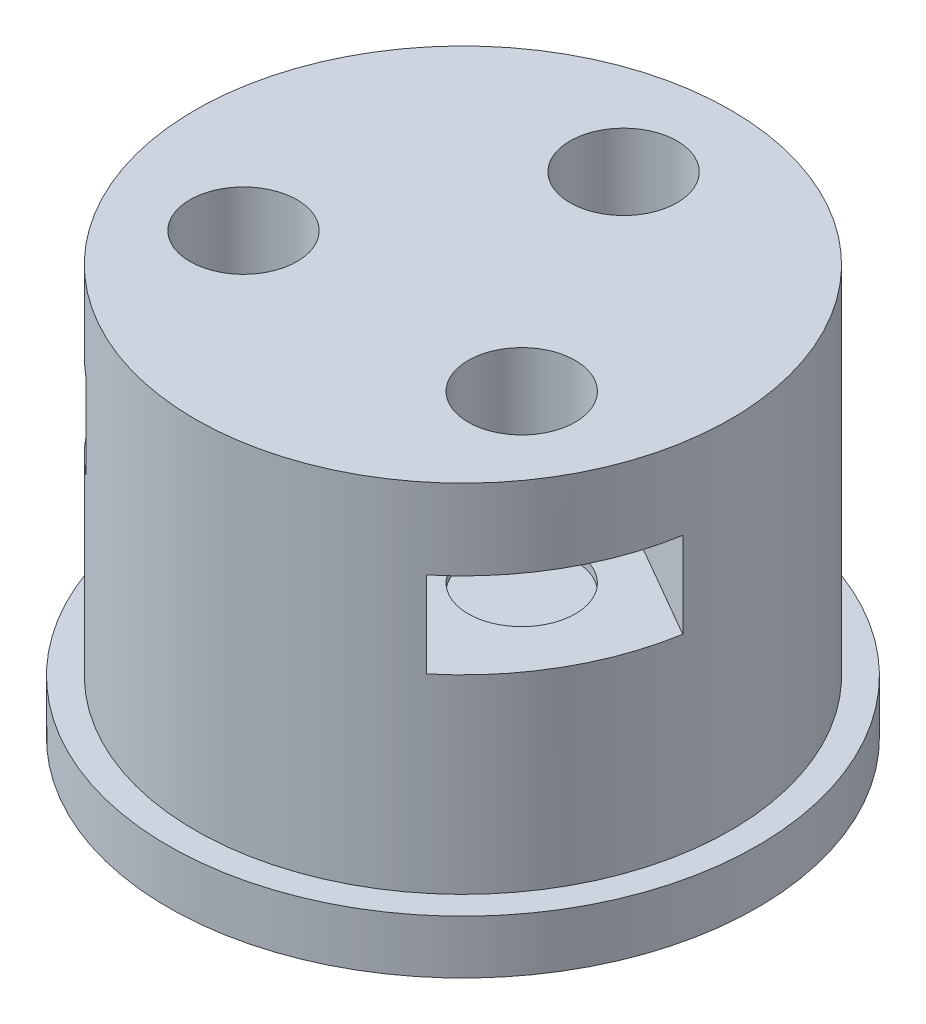
from build123d import *

# Parameters (mm, degrees)
SKETCH1_R           = 10
BOSS_EXTRUDE1_DEPTH = 15.3
SKETCH2_R           = 11
SKETCH2_R_2         = 10
BOSS_EXTRUDE2_DEPTH = 2
SKETCH3_R           = 6
CUT_EXTRUDE1_DEPTH  = 5
SKETCH4_R           = 2
CUT_EXTRUDE2_DEPTH  = 6.5
CUT_EXTRUDE3_START  = -3
SKETCH5_R           = 2
CUT_EXTRUDE3_DEPTH  = 3.2
BOSS_EXTRUDE3_START = -3.5
SKETCH6_R           = 6
SKETCH6_R_2         = 5
BOSS_EXTRUDE3_DEPTH = 1.5


with BuildPart() as part:
    # Sketch1 → Boss-Extrude1 (new body)
    with BuildSketch(Plane(origin=(0, 0, 0), x_dir=(1, 0, 0), z_dir=(0, 1, 0))):
        with Locations(Location((0, 0, 0), (0, 0, 270))):
            Circle(SKETCH1_R)
    extrude(amount=BOSS_EXTRUDE1_DEPTH)

    # Sketch2 → Boss-Extrude2 (add)
    with BuildSketch(Plane.XZ):
        with Locations(Location((0, 0, 0), (0, 0, 270))):
            Circle(SKETCH2_R)
        with Locations(Location((0, 0, 0), (0, 0, 270))):
            Circle(SKETCH2_R_2, mode=Mode.SUBTRACT)
    extrude(amount=-BOSS_EXTRUDE2_DEPTH)

    # Sketch3 → Cut-Extrude1 (cut)
    with BuildSketch(Plane.XZ):
        with Locations(Location((0, 0, 0), (0, 0, 270))):
            Circle(SKETCH3_R)
    extrude(amount=-CUT_EXTRUDE1_DEPTH, mode=Mode.SUBTRACT)

    # Sketch4 → Cut-Extrude2 (cut)
    with BuildSketch(Plane(origin=(0, 15.3, 0), x_dir=(1, 0, 0), z_dir=(0, 1, 0))):
        with Locations(Location((0, 6, 0), (0, 0, 270))):
            Circle(SKETCH4_R)
        with Locations(Location((5.196152423, -3, 0), (0, 0, 270))):
            Circle(SKETCH4_R)
        with Locations(Location((-5.196152423, -3, 0), (0, 0, 270))):
            Circle(SKETCH4_R)
    extrude(amount=-CUT_EXTRUDE2_DEPTH, mode=Mode.SUBTRACT)

    # Sketch5 → Cut-Extrude3 (cut)
    # profile 1 of 3: a face of its own
    with BuildSketch(Plane(origin=(0, 15.3, 0), x_dir=(1, 0, 0), z_dir=(0, 1, 0)).offset(CUT_EXTRUDE3_START)):
        with BuildLine():
            Line((-3.5, 9.367496998), (-3.5, 3.979274058))
            Line((-3.5, 3.979274058), (0, 1.958548116))
            Line((0, 1.958548116), (3.5, 3.979274058))
            Line((3.5, 3.979274058), (3.5, 9.367496998))
            ThreePointArc((3.5, 9.367496998), (0, 10), (-3.5, 9.367496998))
        make_face()
        with Locations(Location((0, 6, 0), (0, 0, 270))):
            Circle(SKETCH5_R, mode=Mode.SUBTRACT)
    # profile 2 of 3: a face of its own
    with BuildSketch(Plane(origin=(0, 15.3, 0), x_dir=(1, 0, 0), z_dir=(0, 1, 0)).offset(CUT_EXTRUDE3_START)):
        with BuildLine():
            ThreePointArc((-9.86249037, -1.652659586), (-8.660254038, -5), (-6.36249037, -7.714837412))
            Line((-6.36249037, -7.714837412), (-1.696152423, -5.020725942))
            Line((-1.696152423, -5.020725942), (-1.696152423, -0.979274058))
            Line((-1.696152423, -0.979274058), (-5.196152423, 1.041451884))
            Line((-5.196152423, 1.041451884), (-9.86249037, -1.652659586))
        make_face()
        with Locations(Location((-5.196152423, -3, 0), (0, 0, 270))):
            Circle(SKETCH5_R, mode=Mode.SUBTRACT)
    # profile 3 of 3: a face of its own
    with BuildSketch(Plane(origin=(0, 15.3, 0), x_dir=(1, 0, 0), z_dir=(0, 1, 0)).offset(CUT_EXTRUDE3_START)):
        with BuildLine():
            Line((9.86249037, -1.652659586), (5.196152423, 1.041451884))
            Line((5.196152423, 1.041451884), (1.696152423, -0.979274058))
            Line((1.696152423, -0.979274058), (1.696152423, -5.020725942))
            Line((1.696152423, -5.020725942), (6.36249037, -7.714837412))
            ThreePointArc((6.36249037, -7.714837412), (8.660254038, -5), (9.86249037, -1.652659586))
        make_face()
        with Locations(Location((5.196152423, -3, 0), (0, 0, 270))):
            Circle(SKETCH5_R, mode=Mode.SUBTRACT)
    extrude(amount=-CUT_EXTRUDE3_DEPTH, mode=Mode.SUBTRACT)

    # Sketch6 → Boss-Extrude3 (add)
    with BuildSketch(Plane.XZ.offset(BOSS_EXTRUDE3_START)):
        with Locations(Location((0, 0, 0), (0, 0, 270))):
            Circle(SKETCH6_R)
        with Locations(Location((0, 0, 0), (0, 0, 270))):
            Circle(SKETCH6_R_2, mode=Mode.SUBTRACT)
    extrude(amount=-BOSS_EXTRUDE3_DEPTH)


solid = part.part
